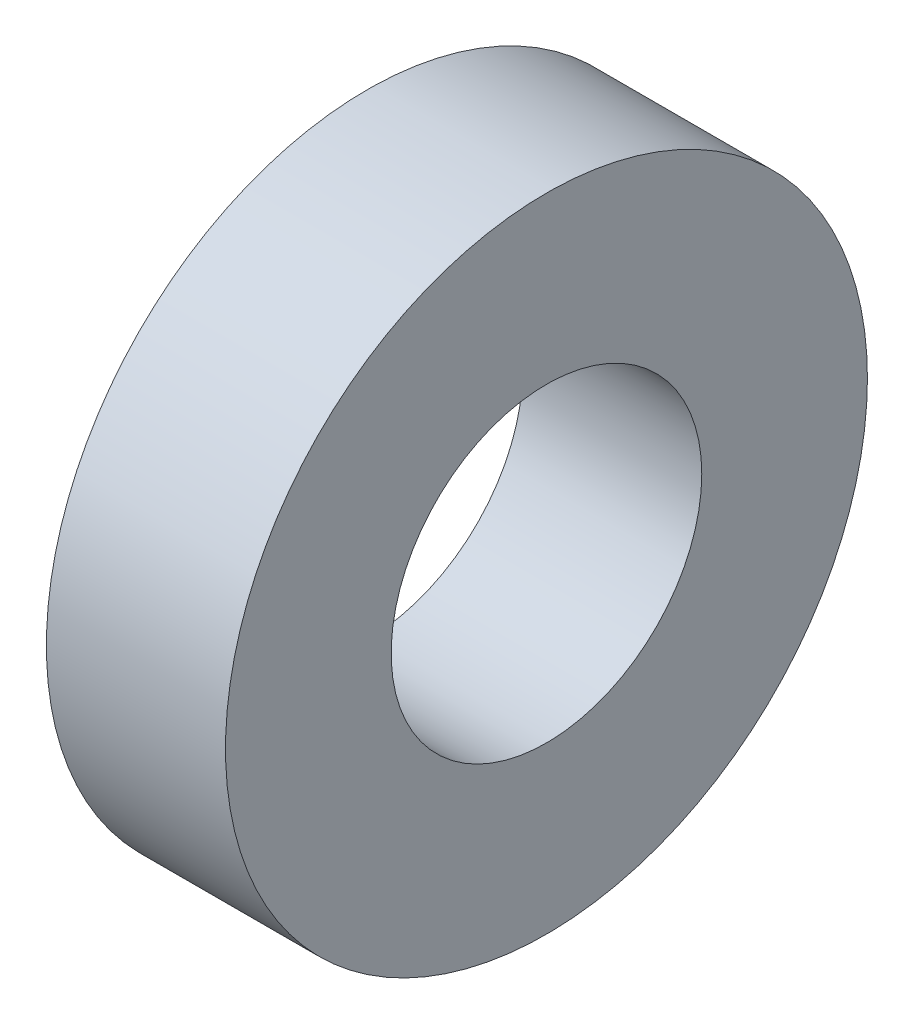
from build123d import *

# Parameters (mm, degrees)
SKETCH_1_R      = 31
SKETCH_1_R_2    = 15
EXTRUDE_1_DEPTH = 17.3


with BuildPart() as part:
    # 草图1 → 凸台-拉伸1 (new body)
    with BuildSketch(Plane(origin=(0, 0, 0), x_dir=(0, 0, -1), z_dir=(1, 0, 0))):
        Circle(SKETCH_1_R)
        Circle(SKETCH_1_R_2, mode=Mode.SUBTRACT)
    extrude(amount=EXTRUDE_1_DEPTH)


solid = part.part
